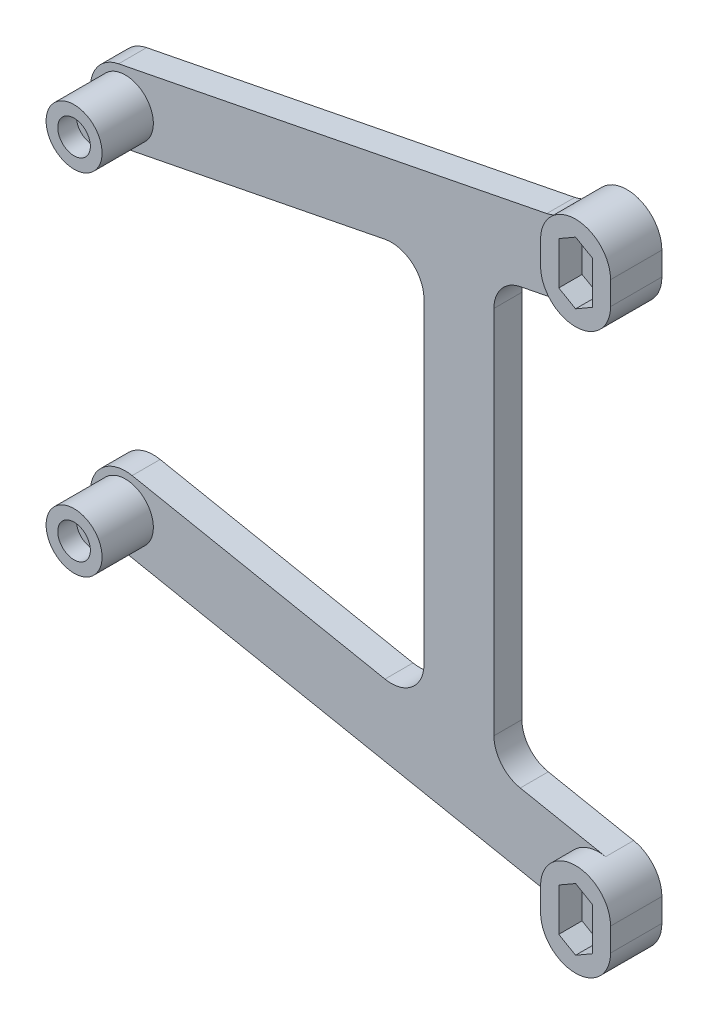
from build123d import *

# Parameters (mm, degrees)
SKETCH1_R           = 4.5
BOSS_EXTRUDE1_DEPTH = 6
SKETCH2_R           = 6
SKETCH2_R_2         = 3.5
BOSS_EXTRUDE2_DEPTH = 11
BOSS_EXTRUDE3_START = -6
SKETCH3_R           = 3.5
SKETCH3_R_2         = 1.65
BOSS_EXTRUDE3_DEPTH = 7
BOSS_EXTRUDE4_DEPTH = 5


with BuildPart() as part:
    # Sketch1 → Boss-Extrude1 (new body)
    with BuildSketch(Plane.XY):
        with BuildLine():
            Line((102.949952293, 87.641492111), (84.646703629, 84.03494065))
            ThreePointArc((84.646703629, 84.03494065), (80.592912741, 81.612614555), (78.999992436, 77.166999954))
            Line((78.999992436, 77.166999954), (78.999992436, -2.166999954))
            ThreePointArc((78.999992436, -2.166999954), (80.592912741, -6.612614555), (84.646703629, -9.03494065))
            Line((84.646703629, -9.03494065), (102.949952293, -12.641492111))
            ThreePointArc((102.949952293, -12.641492111), (107.293299673, -15.2368415), (109, -20))
            Line((109, -20), (109, -25))
            ThreePointArc((109, -25), (103.458898596, -32.239662719), (95.023275656, -28.781804036))
            ThreePointArc((95.023275656, -28.781804036), (93.036589613, -26.607931656), (90.331621742, -25.443547107))
            Line((90.331621742, -25.443547107), (-1.449952293, -7.358507889))
            ThreePointArc((-1.449952293, -7.358507889), (-7.358507889, 1.449952293), (1.449952293, 7.358507889))
            Line((1.449952293, 7.358507889), (55.646703629, -3.320654936))
            ThreePointArc((55.646703629, -3.320654936), (61.445607037, -1.859793935), (63.999992436, 3.54728576))
            Line((63.999992436, 3.54728576), (63.999992436, 71.45271424))
            ThreePointArc((63.999992436, 71.45271424), (61.445607037, 76.859793935), (55.646703629, 78.320654936))
            Line((55.646703629, 78.320654936), (1.449952293, 67.641492111))
            ThreePointArc((1.449952293, 67.641492111), (-7.358507889, 73.550047707), (-1.449952293, 82.358507889))
            Line((-1.449952293, 82.358507889), (90.331621742, 100.443547107))
            ThreePointArc((90.331621742, 100.443547107), (93.036589613, 101.607931655), (95.023275656, 103.781804036))
            ThreePointArc((95.023275656, 103.781804036), (103.458898596, 107.239662719), (109, 100))
            Line((109, 100), (109, 95))
            ThreePointArc((109, 95), (107.293299673, 90.2368415), (102.949952293, 87.641492111))
        make_face()
        Circle(SKETCH1_R, mode=Mode.SUBTRACT)
        with Locations(Location((0, 75, 0), (0, 0, 180))):
            Circle(SKETCH1_R, mode=Mode.SUBTRACT)
        with BuildLine():
            Line((102.6, -25), (102.6, -20))
            ThreePointArc((102.6, -20), (101.5, -18.9), (100.4, -20))
            Line((100.4, -20), (100.4, -25))
            ThreePointArc((100.4, -25), (101.5, -26.1), (102.6, -25))
        make_face(mode=Mode.SUBTRACT)
        with BuildLine():
            Line((100.4, 100), (100.4, 95))
            ThreePointArc((100.4, 95), (101.5, 93.9), (102.6, 95))
            Line((102.6, 95), (102.6, 100))
            ThreePointArc((102.6, 100), (101.5, 101.1), (100.4, 100))
        make_face(mode=Mode.SUBTRACT)
    extrude(amount=BOSS_EXTRUDE1_DEPTH)

    # Sketch2 → Boss-Extrude2 (add)
    # profile 1 of 2: a face of its own
    with BuildSketch(Plane.XY.offset(6)):
        with Locations((0, 75)):
            Circle(SKETCH2_R)
        with Locations((0, 75)):
            Circle(SKETCH2_R_2, mode=Mode.SUBTRACT)
    # profile 2 of 2: a face of its own
    with BuildSketch(Plane.XY.offset(6)):
        Circle(SKETCH2_R)
        Circle(SKETCH2_R_2, mode=Mode.SUBTRACT)
    extrude(amount=BOSS_EXTRUDE2_DEPTH)

    # Sketch3 → Boss-Extrude3 (add)
    # profile 1 of 2: a face of its own
    with BuildSketch(Plane(origin=(0, 0, 0), x_dir=(-1, 0, 0), z_dir=(0, 0, -1)).offset(BOSS_EXTRUDE3_START)):
        with Locations(Location((0, 75, 0), (0, 0, 180))):
            Circle(SKETCH3_R)
        with Locations((0, 75)):
            Circle(SKETCH3_R_2, mode=Mode.SUBTRACT)
    # profile 2 of 2: a face of its own
    with BuildSketch(Plane(origin=(0, 0, 0), x_dir=(-1, 0, 0), z_dir=(0, 0, -1)).offset(BOSS_EXTRUDE3_START)):
        with Locations(Location((0, 0, 0), (0, 0, 180))):
            Circle(SKETCH3_R)
        Circle(SKETCH3_R_2, mode=Mode.SUBTRACT)
    extrude(amount=-BOSS_EXTRUDE3_DEPTH)

    # Sketch4 → Boss-Extrude4 (add)
    # profile 1 of 2: a face of its own
    with BuildSketch(Plane.XY.offset(6)):
        with BuildLine():
            Line((94, -20), (94, -25))
            ThreePointArc((94, -25), (101.5, -32.5), (109, -25))
            Line((109, -25), (109, -20))
            ThreePointArc((109, -20), (101.5, -12.5), (94, -20))
        make_face()
        Polygon((101.5, -15.843078062), (97.9, -17.921539031), (97.9, -27.078460969), (101.5, -29.156921938), (105.1, -27.078460969), (105.1, -17.921539031), align=None, mode=Mode.SUBTRACT)
    # profile 2 of 2: a face of its own
    with BuildSketch(Plane.XY.offset(6)):
        with BuildLine():
            Line((94, 100), (94, 95))
            ThreePointArc((94, 95), (101.5, 87.5), (109, 95))
            Line((109, 95), (109, 100))
            ThreePointArc((109, 100), (101.5, 107.5), (94, 100))
        make_face()
        Polygon((101.5, 104.156921938), (97.9, 102.078460969), (97.9, 92.921539031), (101.5, 90.843078062), (105.1, 92.921539031), (105.1, 102.078460969), align=None, mode=Mode.SUBTRACT)
    extrude(amount=BOSS_EXTRUDE4_DEPTH)


solid = part.part
